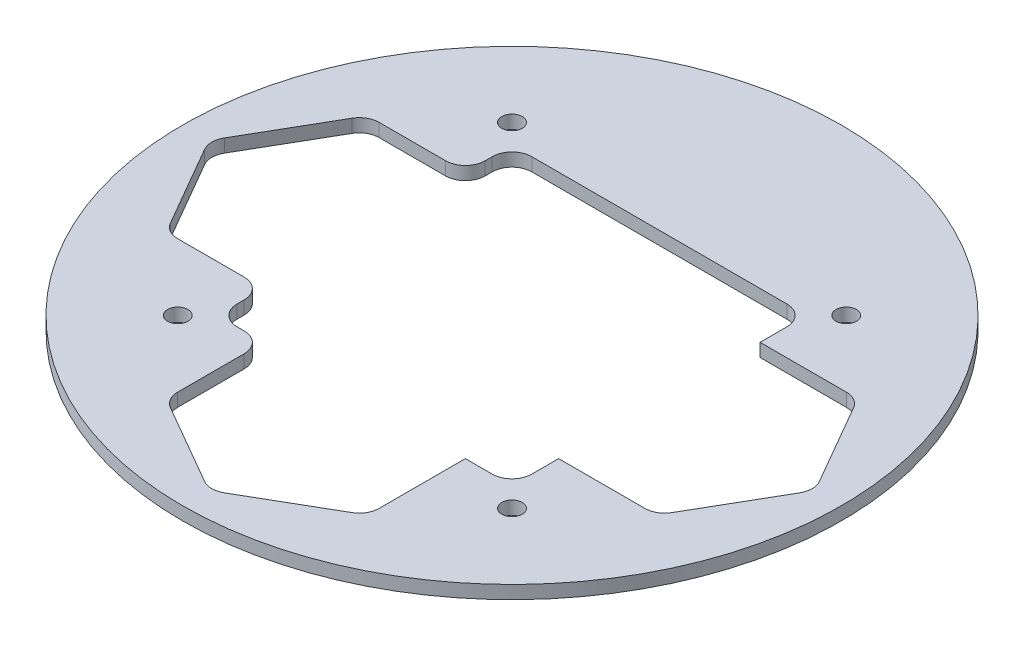
from build123d import *

# Parameters (mm, degrees)
SKETCH1_R           = 50
SKETCH1_R_2         = 1.55
SKETCH1_W           = 30.561449232
SKETCH1_H           = 6
BOSS_EXTRUDE2_DEPTH = 2
FILLET1_R           = 3


with BuildPart() as part:
    # Sketch1 → Boss-Extrude2 (new body)
    # profile 1 of 7: a face of its own
    with BuildSketch(Plane(origin=(0, 0, 0), x_dir=(1, 0, 0), z_dir=(0, 1, 0))):
        with Locations(Location((0, 0, 0), (0, 0, 270))):
            Circle(SKETCH1_R)
        Polygon((-28.355339059, 15.280724616), (-28.355339059, 28.355339059), (-15.280724616, 28.355339059), (-15.280724616, 37.17766953), (0, 46), (15.280724616, 37.17766953), (15.280724616, 28.355339059), (28.355339059, 28.355339059), (28.355339059, 15.280724616), (37.17766953, 15.280724616), (46, 0), (37.17766953, -15.280724616), (28.355339059, -15.280724616), (28.355339059, -28.355339059), (15.280724616, -28.355339059), (15.280724616, -37.17766953), (0, -46), (-15.280724616, -37.17766953), (-15.280724616, -28.355339059), (-28.355339059, -28.355339059), (-28.355339059, -15.280724616), (-37.17766953, -15.280724616), (-46, 0), (-37.17766953, 15.280724616), align=None, mode=Mode.SUBTRACT)
    # profile 2 of 7: a face of its own
    with BuildSketch(Plane(origin=(0, 0, 0), x_dir=(1, 0, 0), z_dir=(0, 1, 0))):
        Polygon((28.355339059, -28.355339059), (28.355339059, -15.280724616), (22.355339059, -15.280724616), (22.355339059, -22.355339059), (15.280724616, -22.355339059), (15.280724616, -28.355339059), align=None)
        with Locations(Location((25.355339059, -25.355339059, 0), (0, 0, 270))):
            Circle(SKETCH1_R_2, mode=Mode.SUBTRACT)
    # profile 3 of 7: a face of its own
    with BuildSketch(Plane(origin=(0, 0, 0), x_dir=(1, 0, 0), z_dir=(0, 1, 0))):
        Polygon((-22.355339059, -15.280724616), (-28.355339059, -15.280724616), (-28.355339059, -28.355339059), (-15.280724616, -28.355339059), (-15.280724616, -22.355339059), (-22.355339059, -22.355339059), align=None)
        with Locations(Location((-25.355339059, -25.355339059, 0), (0, 0, 270))):
            Circle(SKETCH1_R_2, mode=Mode.SUBTRACT)
    # profile 4 of 7: a face of its own
    with BuildSketch(Plane(origin=(0, 0, 0), x_dir=(1, 0, 0), z_dir=(0, 1, 0))):
        Polygon((-15.280724616, 28.355339059), (-28.355339059, 28.355339059), (-28.355339059, 15.280724616), (-22.355339059, 15.280724616), (-22.355339059, 22.355339059), (-15.280724616, 22.355339059), align=None)
        with Locations(Location((-25.355339059, 25.355339059, 0), (0, 0, 270))):
            Circle(SKETCH1_R_2, mode=Mode.SUBTRACT)
    # profile 5 of 7: a face of its own
    with BuildSketch(Plane(origin=(0, 0, 0), x_dir=(1, 0, 0), z_dir=(0, 1, 0))):
        Polygon((28.355339059, 28.355339059), (15.280724616, 28.355339059), (15.280724616, 22.355339059), (22.355339059, 22.355339059), (22.355339059, 15.280724616), (28.355339059, 15.280724616), align=None)
        with Locations(Location((25.355339059, 25.355339059, 0), (0, 0, 270))):
            Circle(SKETCH1_R_2, mode=Mode.SUBTRACT)
    # profile 6 of 7: a face of its own
    with BuildSketch(Plane(origin=(0, 0, 0), x_dir=(1, 0, 0), z_dir=(0, 1, 0))):
        with Locations((0, 25.355339059)):
            Rectangle(SKETCH1_W, SKETCH1_H)
    # profile 7 of 7: a face of its own
    with BuildSketch(Plane(origin=(0, 0, 0), x_dir=(1, 0, 0), z_dir=(0, 1, 0))):
        Polygon((-15.280724616, 37.17766953), (-15.280724616, 28.355339059), (15.280724616, 28.355339059), (15.280724616, 37.17766953), (0, 46), align=None)
    extrude(amount=BOSS_EXTRUDE2_DEPTH)

    # Fillet1
    fillet1_edges = [part.edges().sort_by_distance(p)[0] for p in [
        (-22.355339059, 1, -15.280724616),
        (-37.17766953, 1, -15.280724616),
        (-46, 1, 0),
        (-37.17766953, 1, 15.280724616),
        (-22.355339059, 1, 15.280724616),
        (-22.355339059, 1, 22.355339059),
        (-15.280724616, 1, 22.355339059),
        (-15.280724616, 1, 37.17766953),
        (0, 1, 46),
        (15.280724616, 1, 37.17766953),
        (22.355339059, 1, 22.355339059),
        (37.17766953, 1, 15.280724616),
        (46, 1, 0),
        (37.17766953, 1, -15.280724616),
        (22.355339059, 1, -22.355339059),
        (-22.355339059, 1, -22.355339059),
    ]]
    fillet(fillet1_edges, radius=FILLET1_R)


solid = part.part
